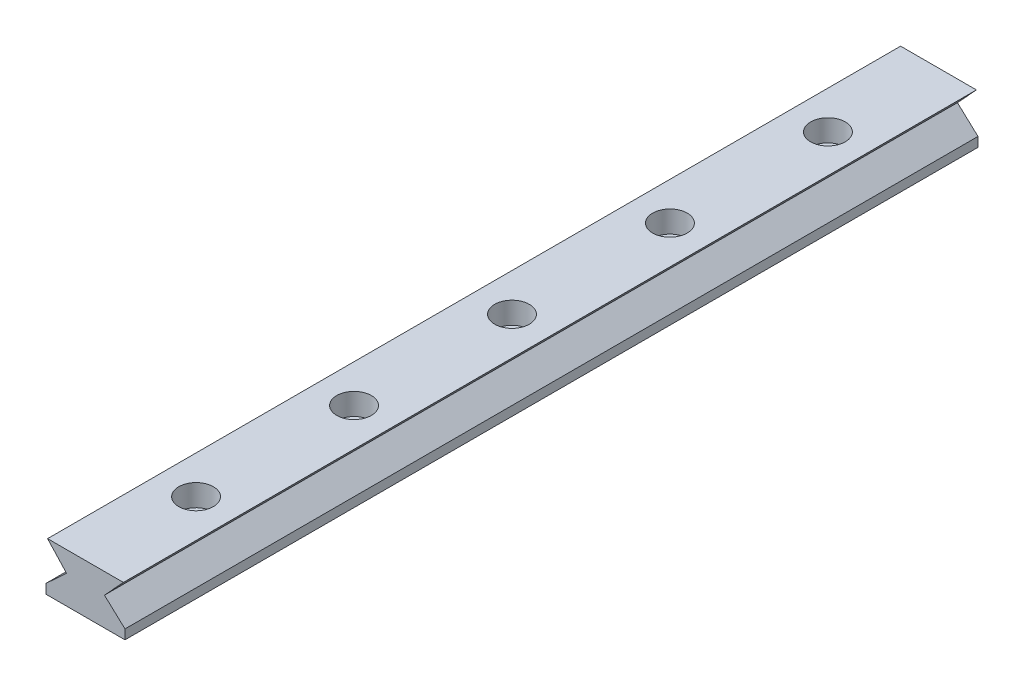
from build123d import *

# Parameters (mm, degrees)
BOSS_EXTRUDE1_DEPTH = 88.9
LPATTERN2_COUNT     = 7
LPATTERN2_PITCH     = 25.4
SKETCH4_W           = 18.597058872
SKETCH4_H           = 20.764352928
SKETCH4_W_2         = 25.241981834
SKETCH4_H_2         = 23.038412947
CUT_EXTRUDE1_DEPTH  = 90.473640677


with BuildPart() as part:
    # Sketch1 → Boss-Extrude1 (new, symmetric)
    with BuildSketch(Plane.XY):
        Polygon((-6.096, 7.874), (6.096, 7.874), (3.048, 4.572), (6.35, 1.524), (6.35, 0), (-6.35, 0), (-6.35, 1.524), (-3.048, 4.572), align=None)
    extrude(amount=BOSS_EXTRUDE1_DEPTH, both=True)

    # Sketch2 → Cut-Revolve1 (revolve, cut)
    with BuildSketch(Plane(origin=(0, 0, 0), x_dir=(0, 0, -1), z_dir=(1, 0, 0)), mode=Mode.PRIVATE) as cut_revolve1_sk:
        Polygon((-78.9813, 7.874), (-78.9813, 4.3688), (-77.9272, 4.3688), (-77.9272, 0), (-76.2, 0), (-76.2, 7.874), align=None)
    cut_revolve1 = revolve(cut_revolve1_sk.sketch.rotate(Axis((0, 0, 76.2), (0, 1, 0)), 180), axis=Axis((0, 0, 76.2), (0, 1, 0)), mode=Mode.SUBTRACT)

    # LPattern2: Cut-Revolve1 ×7
    with Locations(*[(0, 0, -i * LPATTERN2_PITCH) for i in range(1, LPATTERN2_COUNT)]):
        add(cut_revolve1, mode=Mode.SUBTRACT)

    # Sketch4 → Cut-Extrude1 (cut, through all)
    with BuildSketch(Plane(origin=(0, 7.874, 0), x_dir=(1, 0, 0), z_dir=(0, 1, 0))):
        with Locations((0, 78.962176464)):
            Rectangle(SKETCH4_W, SKETCH4_H)
        with Locations((0, -80.099206474)):
            Rectangle(SKETCH4_W_2, SKETCH4_H_2)
    extrude(amount=-CUT_EXTRUDE1_DEPTH, mode=Mode.SUBTRACT)


solid = part.part
